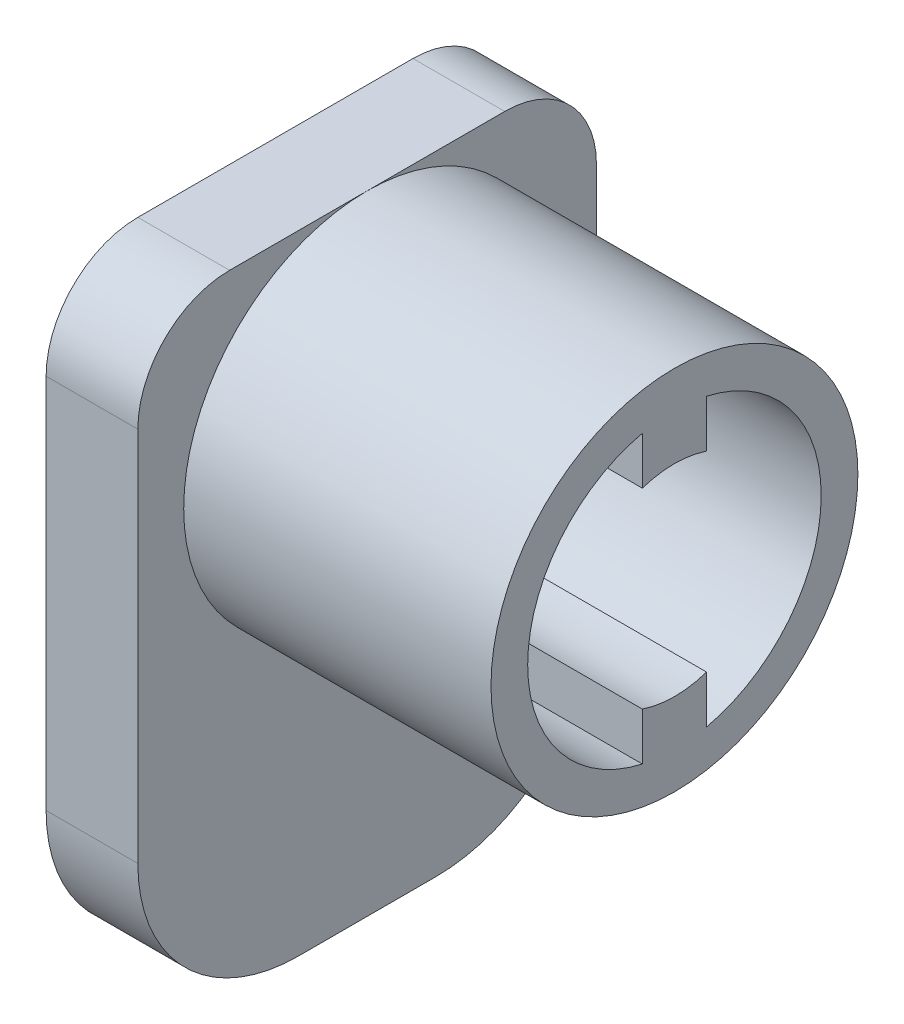
from build123d import *

# Parameters (mm, degrees)
SKETCH2_R           = 4
BOSS_EXTRUDE1_DEPTH = 6.7
SKETCH3_W           = 10
SKETCH3_H           = 13.7
BOSS_EXTRUDE2_DEPTH = 2
SKETCH4_R           = 3.2
CUT_EXTRUDE1_DEPTH  = 6.7
SKETCH7_R           = 1.6
CUT_EXTRUDE4_DEPTH  = 14.956360557
BOSS_EXTRUDE3_START = -8.7
BOSS_EXTRUDE3_DEPTH = 8.7
FILLET2_R           = 2
FILLET3_R           = 3.5


with BuildPart() as part:
    # Sketch2 → Boss-Extrude1 (new body)
    with BuildSketch(Plane(origin=(0, 0, 0), x_dir=(0, 0, -1), z_dir=(1, 0, 0))):
        Circle(SKETCH2_R)
    extrude(amount=-BOSS_EXTRUDE1_DEPTH)

    # Sketch3 → Boss-Extrude2 (add)
    with BuildSketch(Plane.ZY.offset(6.7)):
        with Locations((0, -2.85)):
            Rectangle(SKETCH3_W, SKETCH3_H)
    extrude(amount=BOSS_EXTRUDE2_DEPTH)

    # Sketch4 → Cut-Extrude1 (cut)
    with BuildSketch(Plane(origin=(0, 0, 0), x_dir=(0, 0, -1), z_dir=(1, 0, 0))):
        Circle(SKETCH4_R)
    extrude(amount=-CUT_EXTRUDE1_DEPTH, mode=Mode.SUBTRACT)

    # Sketch7 → Cut-Extrude4 (cut, through all)
    with BuildSketch(Plane.ZY.offset(8.7)):
        Circle(SKETCH7_R)
    extrude(amount=-CUT_EXTRUDE4_DEPTH, mode=Mode.SUBTRACT)

    # Sketch6 → Boss-Extrude3 (add)
    with BuildSketch(Plane.ZY.offset(8.7).offset(BOSS_EXTRUDE3_START)):
        with BuildLine():
            Line((0.7, -2.861817604), (0.7, -2.085665361))
            ThreePointArc((0.7, -2.085665361), (0, -2.2), (-0.7, -2.085665361))
            Line((-0.7, -2.085665361), (-0.7, -2.861817604))
            Line((-0.7, -2.861817604), (-0.7, -3.122498999))
            ThreePointArc((-0.7, -3.122498999), (0, -3.2), (0.7, -3.122498999))
            Line((0.7, -3.122498999), (0.7, -2.861817604))
        make_face()
        with BuildLine():
            Line((-0.7, 2.085665361), (-0.7, 2.861817604))
            Line((-0.7, 2.861817604), (-0.7, 3.122498999))
            ThreePointArc((-0.7, 3.122498999), (0, 3.2), (0.7, 3.122498999))
            Line((0.7, 3.122498999), (0.7, 2.861817604))
            Line((0.7, 2.861817604), (0.7, 2.085665361))
            ThreePointArc((0.7, 2.085665361), (0, 2.2), (-0.7, 2.085665361))
        make_face()
    extrude(amount=BOSS_EXTRUDE3_DEPTH)

    # Fillet2
    fillet2_edges = [part.edges().sort_by_distance(p)[0] for p in [
        (-7.7, 4, -5),
        (-7.7, 4, 5),
    ]]
    fillet(fillet2_edges, radius=FILLET2_R)

    # Fillet3
    fillet3_edges = [part.edges().sort_by_distance(p)[0] for p in [
        (-7.7, -9.7, -5),
        (-7.7, -9.7, 5),
    ]]
    fillet(fillet3_edges, radius=FILLET3_R)


solid = part.part
